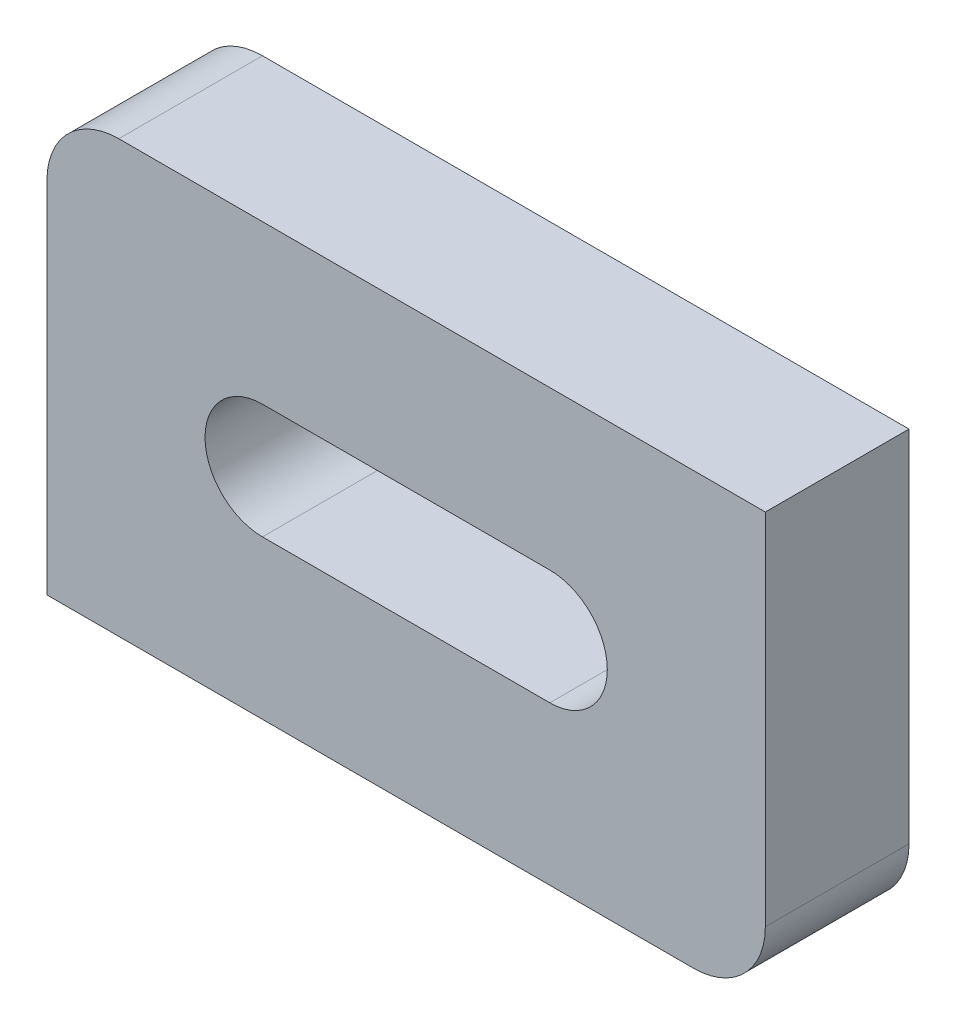
from build123d import *

# Parameters (mm, degrees)
BOSS_EXTRUDE1_DEPTH = 10


with BuildPart() as part:
    # Sketch1 → Boss-Extrude1 (new body)
    with BuildSketch(Plane.XY):
        with BuildLine():
            Line((0, 0), (45, 0))
            ThreePointArc((45, 0), (48.535533906, 1.464466094), (50, 5))
            Line((50, 5), (50, 30))
            Line((50, 30), (5, 30))
            ThreePointArc((5, 30), (1.464466094, 28.535533906), (0, 25))
            Line((0, 25), (0, 0))
        make_face()
        with BuildLine():
            Line((15, 19), (35, 19))
            ThreePointArc((35, 19), (39, 15), (35, 11))
            Line((35, 11), (15, 11))
            ThreePointArc((15, 11), (11, 15), (15, 19))
        make_face(mode=Mode.SUBTRACT)
    extrude(amount=BOSS_EXTRUDE1_DEPTH)


solid = part.part
